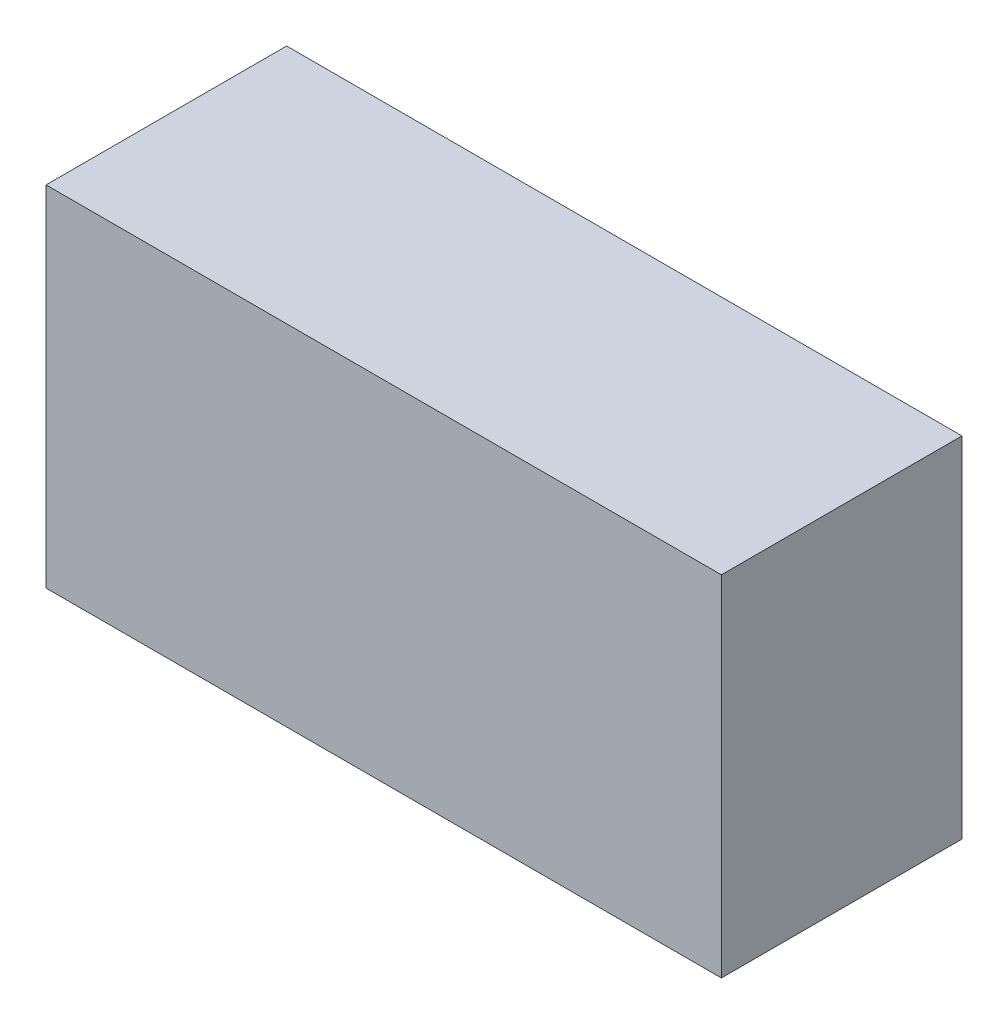
from build123d import *

# Parameters (mm, degrees)
SKETCH1_W           = 19.65
SKETCH1_H           = 7
BOSS_EXTRUDE1_DEPTH = 10.16
SKETCH2_R           = 0.25
BOSS_EXTRUDE2_DEPTH = 4.1


with BuildPart() as part:
    # Sketch1 → Boss-Extrude1 (new body)
    with BuildSketch(Plane(origin=(0, 0, 0), x_dir=(1, 0, 0), z_dir=(0, 1, 0))):
        Rectangle(SKETCH1_W, SKETCH1_H)
    extrude(amount=BOSS_EXTRUDE1_DEPTH)

    # Sketch2 → Boss-Extrude2 (add)
    with BuildSketch(Plane.XZ):
        with Locations(Location((0.005, -2.8, 0), (0, 0, 90))):
            Circle(SKETCH2_R)
        with Locations(Location((2.545, -2.8, 0), (0, 0, 90))):
            Circle(SKETCH2_R)
        with Locations(Location((5.085, -2.8, 0), (0, 0, 90))):
            Circle(SKETCH2_R)
        with Locations(Location((-5.075, -2.8, 0), (0, 0, 90))):
            Circle(SKETCH2_R)
        with Locations(Location((-7.615, -2.8, 0), (0, 0, 90))):
            Circle(SKETCH2_R)
    extrude(amount=BOSS_EXTRUDE2_DEPTH)


solid = part.part
